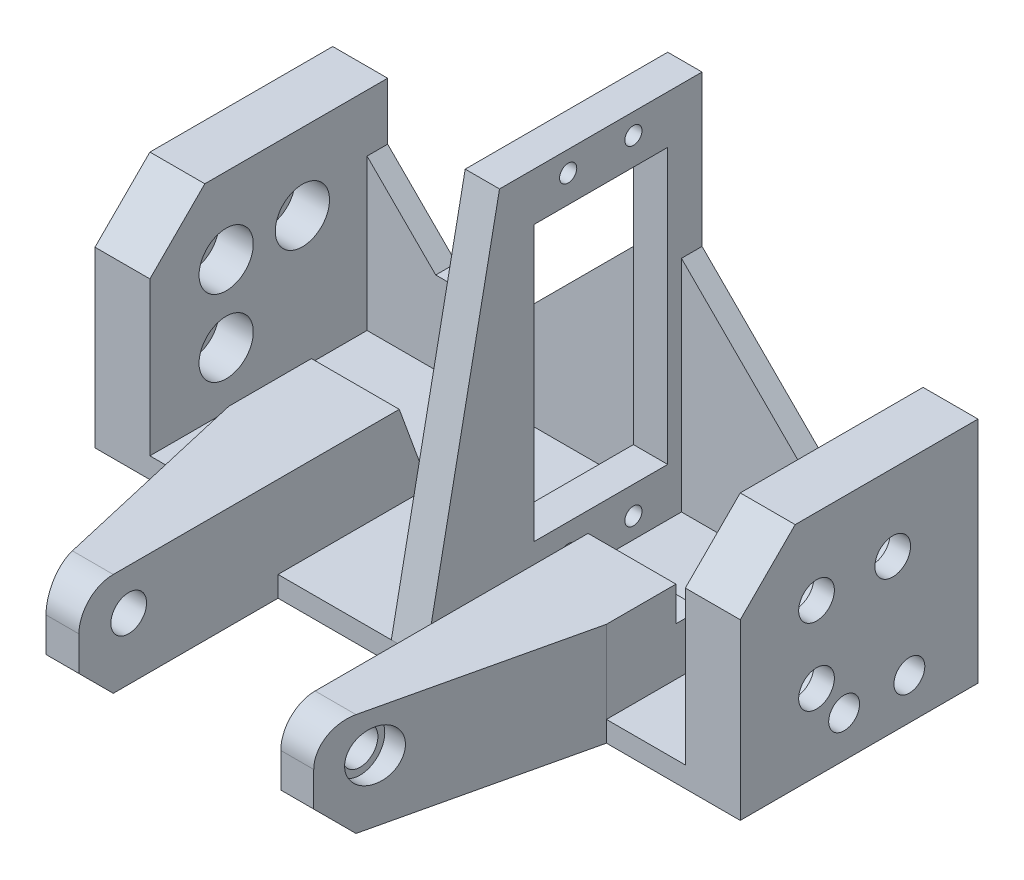
from build123d import *

# Parameters (mm, degrees)
EXTRUDE_1_DEPTH             = 34.63
SKETCH_2_R                  = 2.6
CUT_EXTRUDE_1_DEPTH         = 106.56315361
EXTRUDE_2_DEPTH             = 3
SKETCH_4_W                  = 46.659566201
SKETCH_4_H                  = 12
SKETCH_4_R                  = 2.6
EXTRUDE_3_DEPTH             = 12.8
DRAFT_1_ANGLE               = 20
CUT_EXTRUDE_2_DEPTH         = 90.021233563
SKETCH_6_R                  = 3.6
CUT_EXTRUDE_3_DEPTH         = 28
FILLET_1_R                  = 5
CHAMFER_1_SIZE              = 5
DRAFT_1_OF_MIRROR_3_2_ANGLE = 20
CHAMFER_2_SIZE              = 5
FILLET_2_R                  = 5
SKETCH_7_W                  = 87.99
SKETCH_7_H                  = 3
EXTRUDE_4_DEPTH             = 12
SKETCH_8_R                  = 3.95
EXTRUDE_5_DEPTH             = 5
CHAMFER_3_SIZE              = 8
CHAMFER_4_SIZE              = 10
SKETCH_9_W                  = 19.5
SKETCH_9_H                  = 40
EXTRUDE_6_DEPTH             = 5
SKETCH_9_3_W                = 19.5
SKETCH_9_3_H                = 40
CUT_EXTRUDE_4_DEPTH         = 30
EXTRUDE_7_DEPTH             = 5
CHAMFER_5_SIZE              = 20
SKETCH_11_R                 = 1.25
CUT_EXTRUDE_5_DEPTH         = 5
SKETCH_12_R                 = 2.25
CUT_EXTRUDE_6_DEPTH         = 105.59373607


with BuildPart() as part:
    # Эскиз1 → Бобышка-Вытянуть1 (new body)
    with BuildSketch(Plane.XY):
        Polygon((-43.995, 3), (43.995, 3), (43.995, 33.32), (46.995, 33.32), (46.995, 0), (-46.995, 0), (-46.995, 33.32), (-43.995, 33.32), align=None)
    extrude(amount=EXTRUDE_1_DEPTH)

    # Эскиз2 → Вырез-Вытянуть1 (cut, through all)
    with BuildSketch(Plane.ZY.offset(46.995)):
        with Locations(Location((12.418647532, 22.211352468, 0), (0, 0, 270))):
            Circle(SKETCH_2_R)
        with Locations(Location((23.521352468, 22.211352468, 0), (0, 0, 270))):
            Circle(SKETCH_2_R)
        with Locations(Location((23.521352468, 11.108647532, 0), (0, 0, 270))):
            Circle(SKETCH_2_R)
    extrude(amount=-CUT_EXTRUDE_1_DEPTH, mode=Mode.SUBTRACT)

    # Эскиз3 → Бобышка-Вытянуть2 (add)
    with BuildSketch(Plane(origin=(0, 0, 0), x_dir=(1, 0, 0), z_dir=(0, 1, 0))):
        Polygon((-27.5, -34.63), (27.5, -34.63), (19.5, -69.26), (14.7, -69.26), (14.7, -40.26), (-14.7, -40.26), (-14.7, -69.26), (-19.5, -69.26), align=None)
    extrude(amount=EXTRUDE_2_DEPTH)

    # Эскиз4 → Бобышка-Вытянуть3 (add)
    with BuildSketch(Plane.ZY.offset(-14.7)):
        with Locations((45.9302169, 9)):
            Rectangle(SKETCH_4_W, SKETCH_4_H)
        with Locations((62.01, 9)):
            Circle(SKETCH_4_R, mode=Mode.SUBTRACT)
    extrude_3 = extrude(amount=-EXTRUDE_3_DEPTH)

    # Уклон1
    draft_1_faces = [part.faces().sort_by_distance(p)[0] for p in [
        (21.1, 9, 22.600433799),
    ]]
    draft(draft_1_faces, Plane(origin=(27.5, 15, 22.600433799), x_dir=(0, 0, 1), z_dir=(0, 1, 0)), DRAFT_1_ANGLE)

    # Эскиз5 → Вырез-Вытянуть2 (cut, through all)
    with BuildSketch(Plane.XZ.offset(-3)):
        Polygon((27.5, 34.63), (27.5, 69.26), (19.5, 69.26), align=None)
    cut_extrude_2 = extrude(amount=-CUT_EXTRUDE_2_DEPTH, mode=Mode.SUBTRACT)

    # Эскиз6 → Вырез-Вытянуть3 (cut)
    with BuildSketch(Plane(origin=(46.995, 0, 0), x_dir=(0, 0, -1), z_dir=(1, 0, 0))):
        with Locations(Location((-62.01, 9, 0), (0, 0, 90))):
            Circle(SKETCH_6_R)
    cut_extrude_3 = extrude(amount=-CUT_EXTRUDE_3_DEPTH, mode=Mode.SUBTRACT)

    # Скругление1
    fillet_1_edges = [part.edges().sort_by_distance(p)[0] for p in [
        (17.1, 15, 69.26),
    ]]
    fillet(fillet_1_edges, radius=FILLET_1_R)

    # Фаска1
    chamfer_1_edges = [part.edges().sort_by_distance(p)[0] for p in [
        (17.1, 0, 69.26),
    ]]
    chamfer(chamfer_1_edges, length=CHAMFER_1_SIZE)

    # Зеркальное отражение3: Бобышка-Вытянуть3, Вырез-Вытянуть2, Вырез-Вытянуть3 across plane
    add(extrude_3.mirror(Plane(origin=(0, 0, 0), x_dir=(0, 0, 1), z_dir=(1, 0, 0))))
    add(cut_extrude_2.mirror(Plane(origin=(0, 0, 0), x_dir=(0, 0, 1), z_dir=(1, 0, 0))), mode=Mode.SUBTRACT)
    add(cut_extrude_3.mirror(Plane(origin=(0, 0, 0), x_dir=(0, 0, 1), z_dir=(1, 0, 0))), mode=Mode.SUBTRACT)

    # Уклон1 of Mirror 3 2
    draft_1_of_mirror_3_2_faces = [part.faces().sort_by_distance(p)[0] for p in [
        (-21.1, 9, 22.600433799),
    ]]
    draft(draft_1_of_mirror_3_2_faces, Plane(origin=(-27.5, 15, 22.600433799), x_dir=(0, 0, 1), z_dir=(0, 1, 0)), DRAFT_1_OF_MIRROR_3_2_ANGLE)

    # Фаска2
    chamfer_2_edges = [part.edges().sort_by_distance(p)[0] for p in [
        (-17.1, 0, 69.26),
    ]]
    chamfer(chamfer_2_edges, length=CHAMFER_2_SIZE)

    # Скругление2
    fillet_2_edges = [part.edges().sort_by_distance(p)[0] for p in [
        (-17.1, 15, 69.26),
    ]]
    fillet(fillet_2_edges, radius=FILLET_2_R)

    # Эскиз7 → Бобышка-Вытянуть4 (add)
    with BuildSketch(Plane(origin=(0, 3, 0), x_dir=(1, 0, 0), z_dir=(0, 1, 0))):
        with Locations((0, -1.5)):
            Rectangle(SKETCH_7_W, SKETCH_7_H)
    extrude(amount=EXTRUDE_4_DEPTH)

    # Эскиз8 → Бобышка-Вытянуть5 (add)
    with BuildSketch(Plane.ZY.offset(-43.995)):
        Polygon((3, 3), (34.63, 3), (34.63, 33.32), (0, 33.32), (0, 15), (3, 15), align=None)
        with Locations((12.418647532, 22.211352468)):
            Circle(SKETCH_8_R, mode=Mode.SUBTRACT)
        with Locations((23.521352468, 22.211352468)):
            Circle(SKETCH_8_R, mode=Mode.SUBTRACT)
        with Locations((23.521352468, 11.108647532)):
            Circle(SKETCH_8_R, mode=Mode.SUBTRACT)
    extrude_5 = extrude(amount=EXTRUDE_5_DEPTH)

    # Зеркальное отражение4: Бобышка-Вытянуть5 across plane
    add(extrude_5.mirror(Plane(origin=(0, 0, 0), x_dir=(0, 0, 1), z_dir=(1, 0, 0))))

    # Фаска3
    chamfer_3_edges = [part.edges().sort_by_distance(p)[0] for p in [
        (42.995, 33.32, 34.63),
        (-42.995, 33.32, 34.63),
    ]]
    chamfer(chamfer_3_edges, length=CHAMFER_3_SIZE)

    # Фаска4
    chamfer_4_edges = [part.edges().sort_by_distance(p)[0] for p in [
        (38.995, 15, 1.5),
        (-38.995, 15, 1.5),
    ]]
    chamfer(chamfer_4_edges, length=CHAMFER_4_SIZE)

    # Эскиз9 → Бобышка-Вытянуть6 (add)
    with BuildSketch(Plane(origin=(6.8, 0, 0), x_dir=(0, 0, -1), z_dir=(1, 0, 0))):
        Polygon((-5, 3), (0, 3), (0, 10), (0, 50), (0, 57), (-5, 57), (-24.5, 57), (-29.5, 57), (-29.5, 50), (-29.5, 10), (-29.5, 3), (-24.5, 3), align=None)
        with Locations((-14.75, 30)):
            Rectangle(SKETCH_9_W, SKETCH_9_H, mode=Mode.SUBTRACT)
    extrude(amount=-EXTRUDE_6_DEPTH)

    # Эскиз9<3> → Вырез-Вытянуть4 (cut)
    with BuildSketch(Plane(origin=(6.8, 0, 0), x_dir=(0, 0, -1), z_dir=(1, 0, 0))):
        with Locations((-14.75, 30)):
            Rectangle(SKETCH_9_3_W, SKETCH_9_3_H)
    extrude(amount=CUT_EXTRUDE_4_DEPTH, mode=Mode.SUBTRACT)

    # Эскиз10 → Бобышка-Вытянуть7 (add)
    with BuildSketch(Plane(origin=(6.8, 0, 0), x_dir=(0, 0, -1), z_dir=(1, 0, 0))):
        Polygon((-29.5, 3), (-29.5, 57), (-40.26, 3), align=None)
    extrude(amount=-EXTRUDE_7_DEPTH)

    # Фаска5
    chamfer_5_edges = [part.edges().sort_by_distance(p)[0] for p in [
        (6.8, 15, 1.5),
        (1.8, 15, 1.5),
    ]]
    chamfer(chamfer_5_edges, length=CHAMFER_5_SIZE)

    # Эскиз11 → Вырез-Вытянуть5 (cut)
    with BuildSketch(Plane(origin=(6.8, 0, 0), x_dir=(0, 0, -1), z_dir=(1, 0, 0))):
        with Locations((-19.5, 54)):
            Circle(SKETCH_11_R)
        with Locations((-10, 54)):
            Circle(SKETCH_11_R)
    cut_extrude_5 = extrude(amount=-CUT_EXTRUDE_5_DEPTH, mode=Mode.SUBTRACT)

    # Зеркальное отражение5: Вырез-Вытянуть5 across plane
    add(cut_extrude_5.mirror(Plane.ZX.offset(30)), mode=Mode.SUBTRACT)

    # Эскиз12 → Вырез-Вытянуть6 (cut, through all)
    with BuildSketch(Plane(origin=(6.8, 0, 0), x_dir=(0, 0, -1), z_dir=(1, 0, 0))):
        with Locations(Location((-19.5, 6, 0), (0, 0, 180))):
            Circle(SKETCH_12_R)
        with Locations(Location((-10, 6, 0), (0, 0, 180))):
            Circle(SKETCH_12_R)
    extrude(amount=CUT_EXTRUDE_6_DEPTH, mode=Mode.SUBTRACT)


solid = part.part
